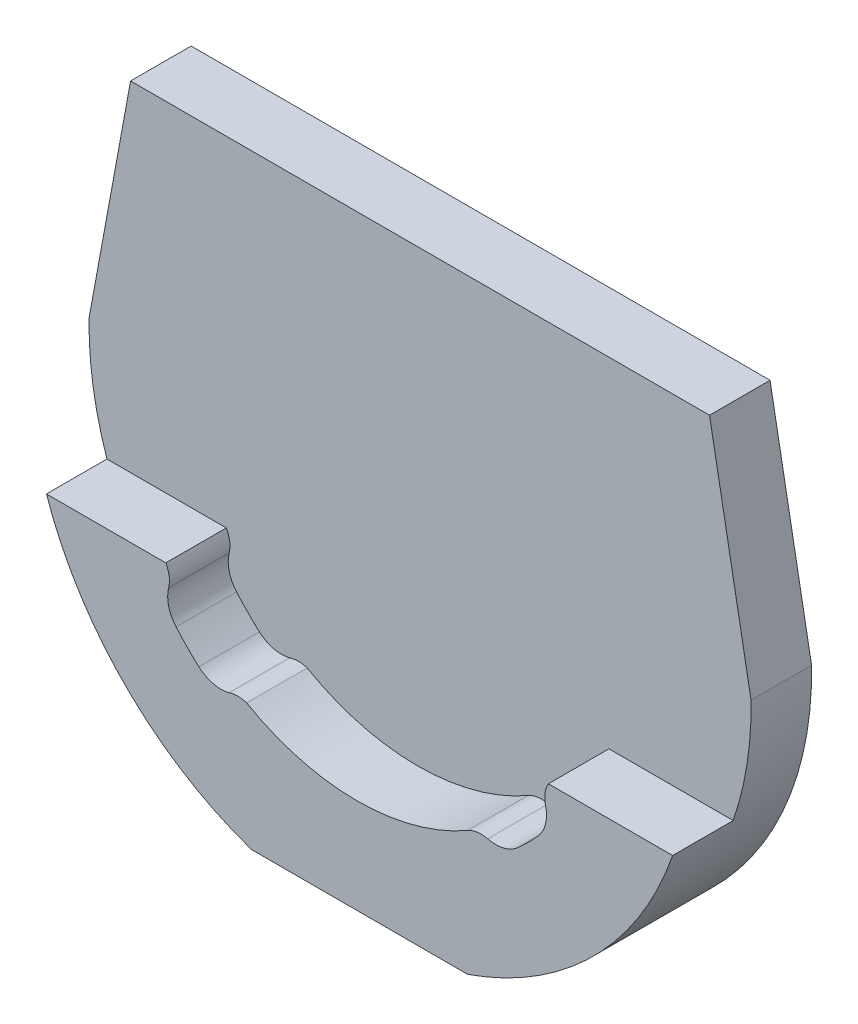
from build123d import *

# Parameters (mm, degrees)
BOSS_EXTRUDE1_DEPTH = 10
SKETCH4_W           = 147.370034426
SKETCH4_H           = 21.427690466
CUT_EXTRUDE1_DEPTH  = 10
SKETCH5_W           = 178.746295464
SKETCH5_H           = 112.332779524
CUT_EXTRUDE2_DEPTH  = 10
BOSS_EXTRUDE2_DEPTH = 10


with BuildPart() as part:
    # Sketch2 → Boss-Extrude1 (new body)
    with BuildSketch(Plane.XY):
        with BuildLine():
            Line((24.926564885, 56.003129771), (45.126564885, -53.996870229))
            ThreePointArc((45.126564885, -53.996870229), (0.426564885, -98.696870229), (-44.273435115, -53.996870229))
            Line((-44.273435115, -53.996870229), (-24.073435115, 56.003129771))
            ThreePointArc((-24.073435115, 56.003129771), (0.426564885, 80.503129771), (24.926564885, 56.003129771))
        make_face()
        with BuildLine():
            ThreePointArc((34.912427768, 56.990682917), (0.426564885, 90.503129771), (-34.059297997, 56.990682917))
            Line((-34.059297997, 56.990682917), (-54.265079147, -53.040798592))
            Line((-54.265079147, -53.040798592), (-44.097865596, -53.040798592))
            Line((-44.097865596, -53.040798592), (-24.073435115, 56.003129771))
            ThreePointArc((-24.073435115, 56.003129771), (0.426564885, 80.503129771), (24.926564885, 56.003129771))
            Line((24.926564885, 56.003129771), (44.950995367, -53.040798592))
            Line((44.950995367, -53.040798592), (55.118208918, -53.040798592))
            Line((55.118208918, -53.040798592), (34.912427768, 56.990682917))
        make_face()
        with BuildLine():
            Line((-44.097865596, -53.040798592), (-54.265079147, -53.040798592))
            ThreePointArc((-54.265079147, -53.040798592), (0.426564885, -108.696870229), (55.118208918, -53.040798592))
            Line((55.118208918, -53.040798592), (44.950995367, -53.040798592))
            Line((44.950995367, -53.040798592), (45.126564885, -53.996870229))
            ThreePointArc((45.126564885, -53.996870229), (0.426564885, -98.696870229), (-44.273435115, -53.996870229))
            Line((-44.273435115, -53.996870229), (-44.097865596, -53.040798592))
        make_face()
    extrude(amount=BOSS_EXTRUDE1_DEPTH)

    # Sketch4 → Cut-Extrude1 (cut)
    with BuildSketch(Plane.XY.offset(10)):
        with Locations((2.831713815, -116.410715462)):
            Rectangle(SKETCH4_W, SKETCH4_H)
    extrude(amount=-CUT_EXTRUDE1_DEPTH, mode=Mode.SUBTRACT)

    # Sketch5 → Cut-Extrude2 (cut)
    with BuildSketch(Plane.XY.offset(10)):
        with Locations((1.072635833, 40.469519533)):
            Rectangle(SKETCH5_W, SKETCH5_H)
    extrude(amount=-CUT_EXTRUDE2_DEPTH, mode=Mode.SUBTRACT)

    # Sketch7 → Boss-Extrude2 (add)
    with BuildSketch(Plane.XY.offset(10)):
        with BuildLine():
            ThreePointArc((18.272585974, -85.111995747), (9.46948112, -88.758361168), (0.022585974, -90.002068509))
            Line((0.022585974, -90.002068509), (0.426564885, -105.696870229))
            Line((0.426564885, -105.696870229), (18.292734033, -105.696870229))
            ThreePointArc((18.292734033, -105.696870229), (39.146778966, -92.634093493), (52.164780298, -71.752068509))
            Line((52.164780298, -71.752068509), (31.632513212, -71.752068509))
            ThreePointArc((31.632513212, -71.752068509), (31.182961311, -72.837382806), (31.029627529, -74.002068509))
            ThreePointArc((31.029627529, -74.002068509), (31.062741779, -74.546982904), (31.161597173, -75.083877552))
            ThreePointArc((31.161597173, -75.083877552), (31.282420431, -75.740082121), (31.322893404, -76.406088604))
            ThreePointArc((31.322893404, -76.406088604), (30.964488909, -78.359033984), (29.935985893, -80.057454127))
            ThreePointArc((29.935985893, -80.057454127), (28.306857221, -81.786339756), (26.577971592, -83.415468427))
            ThreePointArc((26.577971592, -83.415468427), (24.242573732, -84.642622104), (21.604395017, -84.641079707))
            ThreePointArc((21.604395017, -84.641079707), (19.892817757, -84.553395532), (18.272585974, -85.111995747))
        make_face()
        with BuildLine():
            Line((0.426564885, -105.696870229), (0.022585974, -90.002068509))
            ThreePointArc((0.022585974, -90.002068509), (-9.424309172, -88.758361168), (-18.227414026, -85.111995747))
            ThreePointArc((-18.227414026, -85.111995747), (-19.684925655, -84.873628919), (-21.141112037, -85.119962255))
            ThreePointArc((-21.141112037, -85.119962255), (-23.779290752, -85.121504652), (-26.114688612, -83.894350975))
            ThreePointArc((-26.114688612, -83.894350975), (-28.067407493, -82.039534694), (-29.890813945, -80.057454127))
            ThreePointArc((-29.890813945, -80.057454127), (-31.117967622, -77.722056267), (-31.116425225, -75.083877552))
            ThreePointArc((-31.116425225, -75.083877552), (-31.028741049, -73.372300292), (-31.587341264, -71.752068509))
            Line((-31.587341264, -71.752068509), (-51.311650527, -71.752068509))
            ThreePointArc((-51.311650527, -71.752068509), (-38.293649195, -92.634093493), (-17.439604262, -105.696870229))
            Line((-17.439604262, -105.696870229), (0.426564885, -105.696870229))
        make_face()
    extrude(amount=BOSS_EXTRUDE2_DEPTH)


solid = part.part
